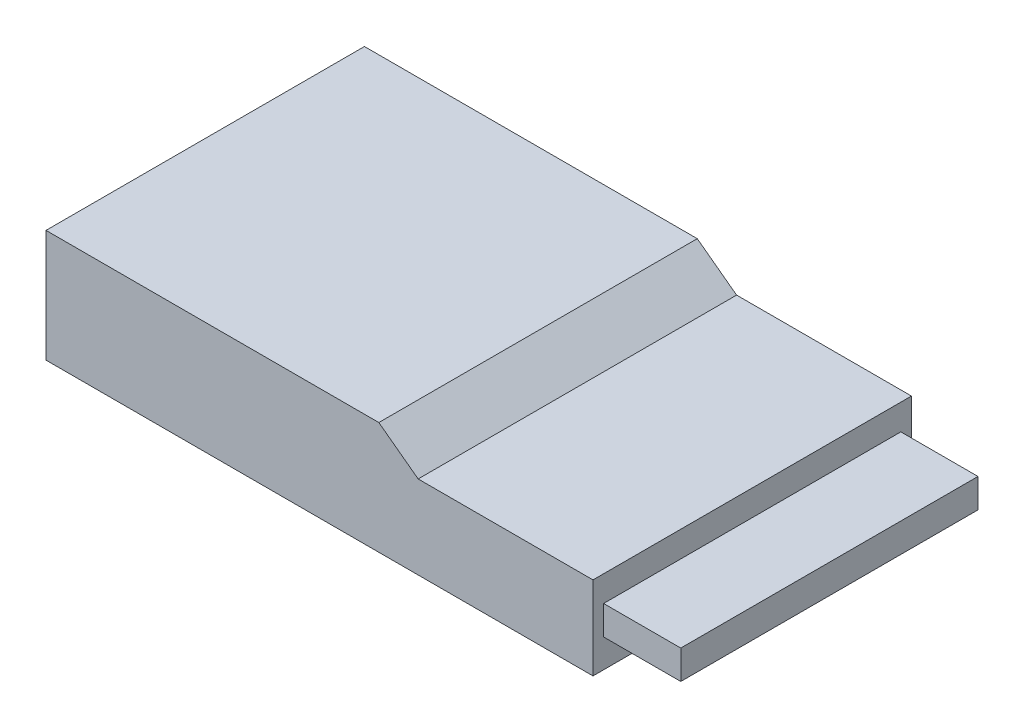
from build123d import *

# Parameters (mm, degrees)
SKETCH1_W           = 21.9
SKETCH1_H           = 12.75
BOSS_EXTRUDE1_DEPTH = 4.5
SKETCH3_W           = 11.9
SKETCH3_H           = 1.16
BOSS_EXTRUDE2_DEPTH = 3.09
CUT_EXTRUDE1_DEPTH  = 13


with BuildPart() as part:
    # Sketch1 → Boss-Extrude1 (new body)
    with BuildSketch(Plane(origin=(0, 0, 0), x_dir=(1, 0, 0), z_dir=(0, 1, 0))):
        Rectangle(SKETCH1_W, SKETCH1_H)
    extrude(amount=BOSS_EXTRUDE1_DEPTH)

    # Sketch3 → Boss-Extrude2 (add)
    with BuildSketch(Plane(origin=(10.95, 0, 0), x_dir=(0, 0, -1), z_dir=(1, 0, 0))):
        with Locations((0, 1.72)):
            Rectangle(SKETCH3_W, SKETCH3_H)
    extrude(amount=BOSS_EXTRUDE2_DEPTH)

    # Sketch4 → Cut-Extrude1 (cut)
    with BuildSketch(Plane.XY.offset(6.375)):
        Polygon((10.95, 3.330806811), (3.95, 3.330806811), (2.375928538, 4.5), (10.95, 4.5), align=None)
    extrude(amount=-CUT_EXTRUDE1_DEPTH, mode=Mode.SUBTRACT)


solid = part.part
